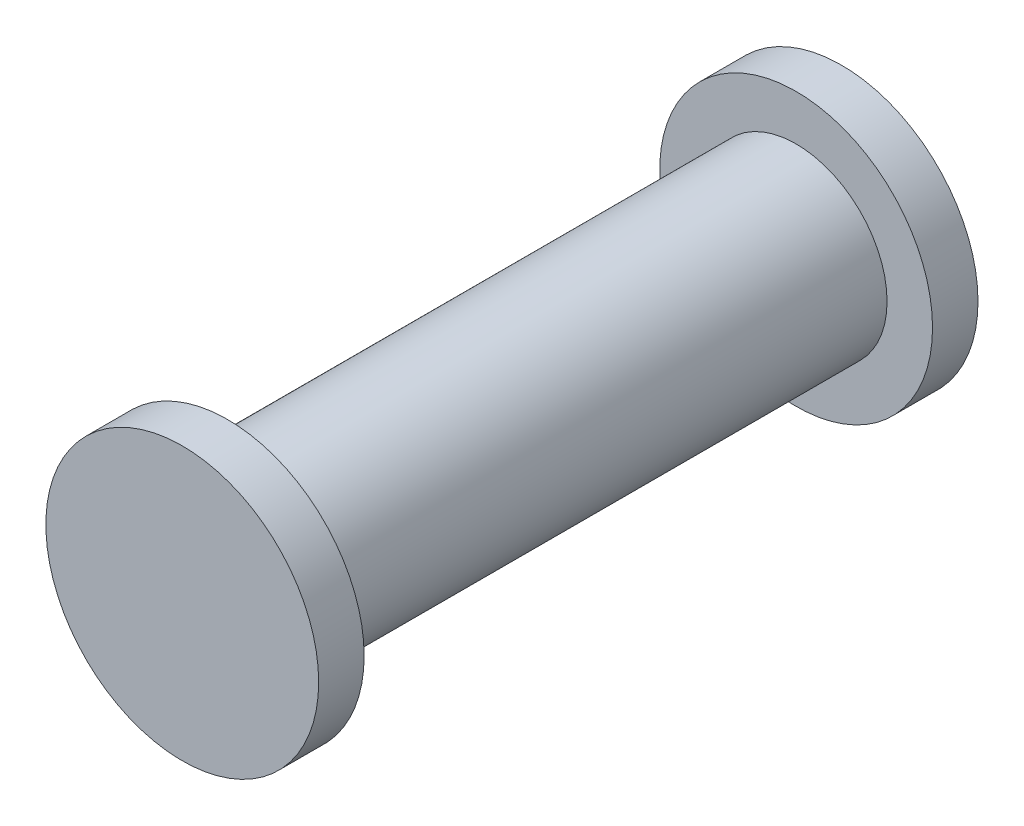
from build123d import *

# Parameters (mm, degrees)
CROQUIS1_R              = 4
SALIENTE_EXTRUIR1_DEPTH = 12.5
CROQUIS2_R              = 6
SALIENTE_EXTRUIR2_DEPTH = 2


with BuildPart() as part:
    # Croquis1 → Saliente-Extruir1 (new, symmetric)
    with BuildSketch(Plane.XY):
        Circle(CROQUIS1_R)
    extrude(amount=SALIENTE_EXTRUIR1_DEPTH, both=True)

    # Croquis2 → Saliente-Extruir2 (add)
    with BuildSketch(Plane.XY.offset(12.5)):
        Circle(CROQUIS2_R)
    saliente_extruir2 = extrude(amount=SALIENTE_EXTRUIR2_DEPTH)

    # Simetría1: Saliente-Extruir2 across plane
    add(saliente_extruir2.mirror(Plane.XY))


solid = part.part
